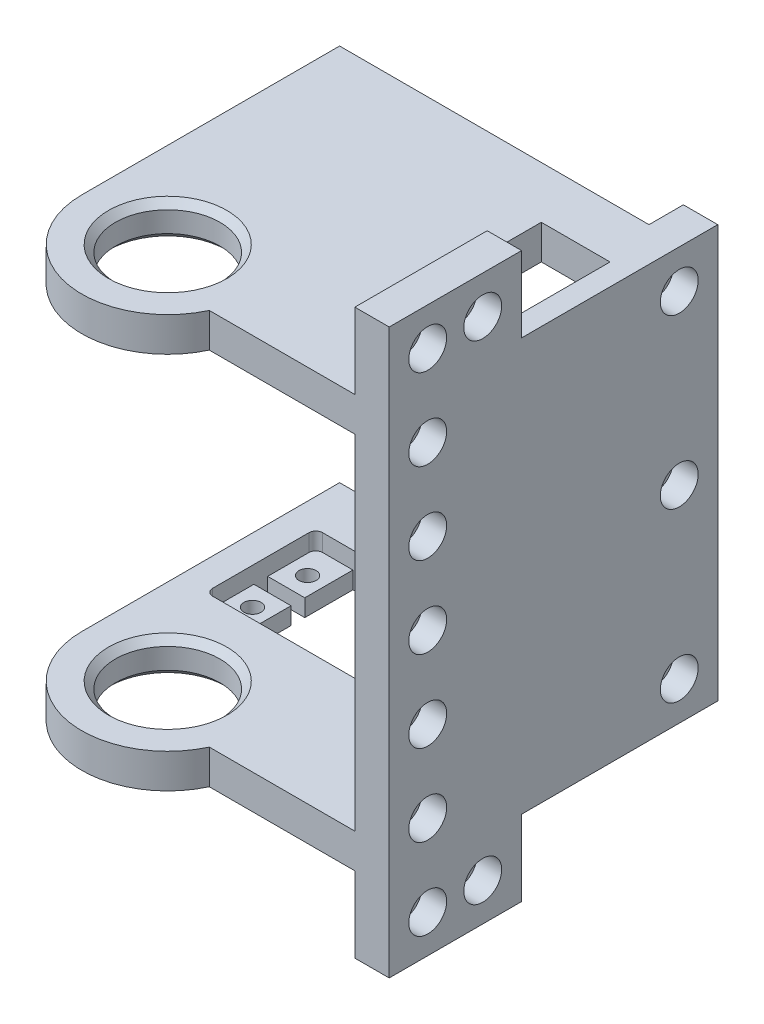
from build123d import *

# Parameters (mm, degrees)
MASS_DEPTH              = 76.2
SKETCH5_R               = 9.652
BEARING_HOLE_DEPTH      = 102.983761741
SKETCH6_W               = 63.5
SKETCH6_H               = 63.5
HOLLOW_DEPTH            = 107.683809823
SKETCH2_R               = 1.5875
SERVO_MOUNT_DEPTH       = 6.35
SERVO_INSET_DEPTH       = 63.5
SERVO_INSET_DEPTH_BACK  = 3.175
SKETCH7_W               = 54.356
SKETCH7_H               = 20.32
BEARING_CHAMFER_SIZE    = 1.27
MINOR_FILLET_R          = 1.27
CUT_EXTRUDE1_DEPTH      = 98.330725666
CUT_EXTRUDE1_DEPTH_BACK = 98.330725666
CUT_EXTRUDE3_DEPTH      = 2.54
CUT_EXTRUDE3_DEPTH_BACK = 98.330725666
SKETCH12_W              = 12.7
SKETCH12_H              = 20.32
SKETCH13_W              = 24.446723308
SKETCH13_H              = 104.14
BOSS_EXTRUDE3_DEPTH     = 6.35
BOSS_EXTRUDE4_DEPTH     = 6.35
SKETCH17_W              = 6.35
SKETCH17_H              = 76.2
BOSS_EXTRUDE5_DEPTH     = 6.35
SKETCH18_R              = 3.5
CUT_EXTRUDE4_DEPTH      = 4.55


with BuildPart() as part:
    # Sketch1 → Mass (new body)
    with BuildSketch(Plane(origin=(0, 0, 0), x_dir=(1, 0, 0), z_dir=(0, 1, 0))):
        with BuildLine():
            Line((-15.270268156, 47.625), (48.229731844, 47.625))
            Line((48.229731844, 47.625), (48.229731844, -9.525))
            Line((48.229731844, -9.525), (0.604731844, -9.525))
            ThreePointArc((0.604731844, -9.525), (-10.620588307, -4.875320151), (-15.270268156, 6.35))
            Line((-15.270268156, 6.35), (-15.270268156, 47.625))
        make_face()
    extrude(amount=MASS_DEPTH)

    # Sketch5 → Bearing Hole (cut, through all)
    with BuildSketch(Plane.XZ):
        with Locations(Location((0.604731844, -6.35, 0), (0, 0, 270))):
            Circle(SKETCH5_R)
    extrude(amount=-BEARING_HOLE_DEPTH, mode=Mode.SUBTRACT)

    # Sketch6 → Hollow (cut, through all)
    with BuildSketch(Plane(origin=(32.780463142, 0, 9.525), x_dir=(-1, 0, 0), z_dir=(0, 0, -1))):
        with Locations((22.650731298, 38.1)):
            Rectangle(SKETCH6_W, SKETCH6_H)
    extrude(amount=HOLLOW_DEPTH, mode=Mode.SUBTRACT)

    # Sketch2 → Servo Mount (cut)
    with BuildSketch(Plane(origin=(0, 6.35, 0), x_dir=(1, 0, 0), z_dir=(0, 1, 0))):
        with Locations(Location((-6.545506188, 39.332658403, 0), (0, 0, 180))):
            Circle(SKETCH2_R)
        with Locations(Location((-6.545506188, 29.162658403, 0), (0, 0, 180))):
            Circle(SKETCH2_R)
        with Locations(Location((40.698493812, 39.332658403, 0), (0, 0, 180))):
            Circle(SKETCH2_R)
        with Locations(Location((40.698493812, 29.162658403, 0), (0, 0, 180))):
            Circle(SKETCH2_R)
        Polygon((-3.243506188, 24.087658403), (37.396493812, 24.087658403), (37.396493812, 32.977658403), (44.254493812, 32.977658403), (44.254493812, 35.517658403), (37.396493812, 35.517658403), (37.396493812, 44.407658403), (-3.243506188, 44.407658403), (-3.243506188, 35.517658403), (-10.101506188, 35.517658403), (-10.101506188, 32.977658403), (-3.243506188, 32.977658403), align=None)
    extrude(amount=-SERVO_MOUNT_DEPTH, mode=Mode.SUBTRACT)

    # Sketch7 → Servo Inset (cut, two sides: drawn at the far end of the back side and taken through both)
    with BuildSketch(Plane(origin=(0, 6.35, 0), x_dir=(1, 0, 0), z_dir=(0, 1, 0)).offset(-SERVO_INSET_DEPTH_BACK)):
        with Locations((17.076493812, 34.247658403)):
            Rectangle(SKETCH7_W, SKETCH7_H)
    extrude(amount=SERVO_INSET_DEPTH + SERVO_INSET_DEPTH_BACK, mode=Mode.SUBTRACT)

    # Bearing Chamfer
    bearing_chamfer_edges = [part.edges().sort_by_distance(p)[0] for p in [
        (0.604731844, 76.2, 3.302),
        (0.604731844, 0, 3.302),
        (0.604731844, 69.85, 3.302),
        (0.604731844, 6.35, 3.302),
    ]]
    chamfer(bearing_chamfer_edges, length=BEARING_CHAMFER_SIZE)

    # Minor fillet
    minor_fillet_edges = [part.edges().sort_by_distance(p)[0] for p in [
        (44.254493812, 36.5125, -44.407658403),
        (44.254493812, 69.85, -34.247658403),
        (44.254493812, 36.5125, -24.087658403),
        (-10.101506188, 4.7625, -24.087658403),
        (-10.101506188, 4.7625, -44.407658403),
    ]]
    fillet(minor_fillet_edges, radius=MINOR_FILLET_R)

    # Sketch9 → Cut-Extrude1 (cut, two sides: drawn at the far end of the back side and taken through both)
    with BuildSketch(Plane(origin=(0, 6.35, 0), x_dir=(1, 0, 0), z_dir=(0, 1, 0)).offset(-CUT_EXTRUDE1_DEPTH_BACK)):
        with BuildLine():
            Line((14.992367963, -0.359064905), (48.229731844, -0.359064905))
            Line((48.229731844, -0.359064905), (48.229731844, -9.525))
            Line((48.229731844, -9.525), (0.604731844, -9.525))
            ThreePointArc((0.604731844, -9.525), (9.134363127, -7.038839202), (14.992367963, -0.359064905))
        make_face()
    extrude(amount=CUT_EXTRUDE1_DEPTH + CUT_EXTRUDE1_DEPTH_BACK, mode=Mode.SUBTRACT)

    # Sketch12 → Cut-Extrude3 (cut, two sides: drawn at the far end of the back side and taken through both)
    with BuildSketch(Plane.XZ.offset(-69.85).offset(-CUT_EXTRUDE3_DEPTH_BACK)):
        with Locations((37.904493812, -34.247658403)):
            Rectangle(SKETCH12_W, SKETCH12_H)
    extrude(amount=CUT_EXTRUDE3_DEPTH + CUT_EXTRUDE3_DEPTH_BACK, mode=Mode.SUBTRACT)

    # Sketch13 → Boss-Extrude3 (add)
    with BuildSketch(Plane.ZY.offset(-41.879731844)):
        with Locations((-11.864296749, 38.1)):
            Rectangle(SKETCH13_W, SKETCH13_H)
    extrude(amount=-BOSS_EXTRUDE3_DEPTH)

    # Sketch16 → Boss-Extrude4 (add)
    with BuildSketch(Plane(origin=(0, 0, -47.625), x_dir=(-1, 0, 0), z_dir=(0, 0, -1))):
        Polygon((-41.879731844, 69.85), (15.270268156, 69.85), (15.270268156, 76.2), (-48.229731844, 76.2), (-48.229731844, 0), (15.270268156, 0), (15.270268156, 6.35), (-41.879731844, 6.35), align=None)
    extrude(amount=BOSS_EXTRUDE4_DEPTH)

    # Sketch17 → Boss-Extrude5 (add)
    with BuildSketch(Plane(origin=(0, 0, -53.975), x_dir=(-1, 0, 0), z_dir=(0, 0, -1))):
        with Locations((-45.054731844, 38.1)):
            Rectangle(SKETCH17_W, SKETCH17_H)
    extrude(amount=BOSS_EXTRUDE5_DEPTH)

    # Sketch18 → Cut-Extrude4 (cut)
    with BuildSketch(Plane(origin=(48.229731844, 0, 0), x_dir=(0, 0, -1), z_dir=(1, 0, 0))):
        with Locations((16.912935095, -6.985)):
            Circle(SKETCH18_R)
        with Locations((6.752935095, -6.985)):
            Circle(SKETCH18_R)
        with Locations((6.752935095, 83.185)):
            Circle(SKETCH18_R)
        with Locations((16.912935095, 83.185)):
            Circle(SKETCH18_R)
        with Locations((53.213, 69.088)):
            Circle(SKETCH18_R)
        with Locations((53.213, 7.112)):
            Circle(SKETCH18_R)
        with Locations((6.752935095, 8.043333333)):
            Circle(SKETCH18_R)
        with Locations((6.752935095, 23.071666667)):
            Circle(SKETCH18_R)
        with Locations((6.752935095, 68.156666667)):
            Circle(SKETCH18_R)
        with Locations((6.752935095, 53.128333333)):
            Circle(SKETCH18_R)
        with Locations((53.213, 38.1)):
            Circle(SKETCH18_R)
        with Locations((6.752935095, 38.1)):
            Circle(SKETCH18_R)
    extrude(amount=-CUT_EXTRUDE4_DEPTH, mode=Mode.SUBTRACT)


solid = part.part
